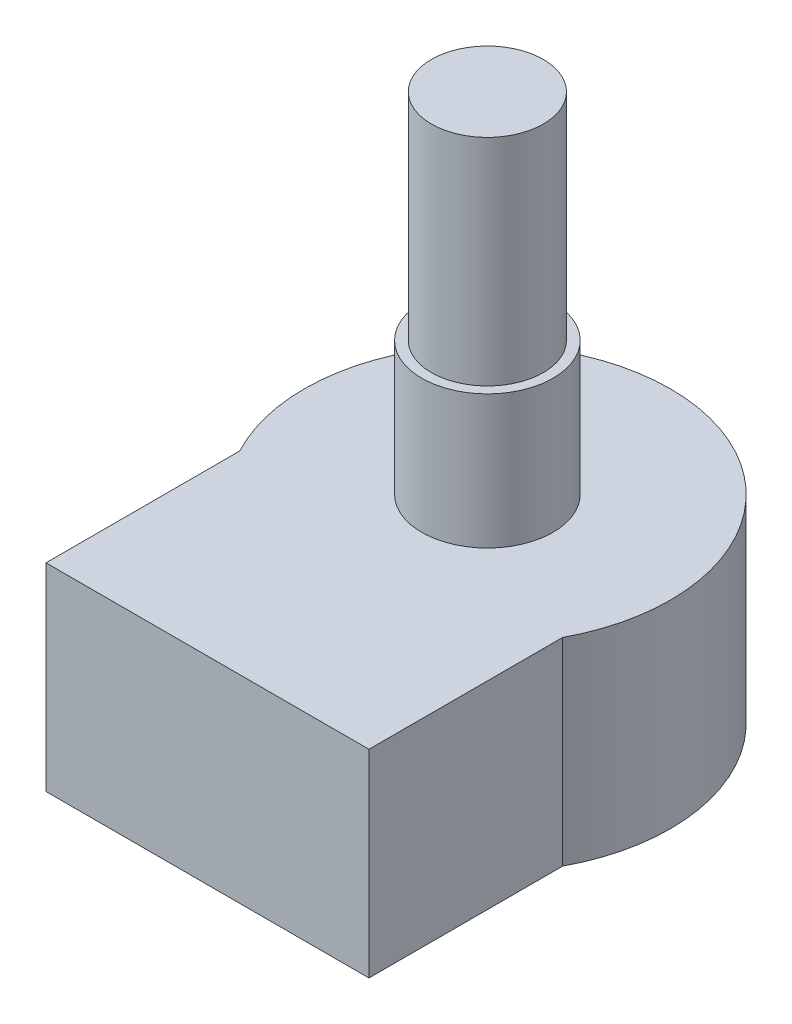
from build123d import *

# Parameters (mm, degrees)
BOSS_EXTRUDE1_DEPTH = 9.2
SKETCH2_R           = 3.05
BOSS_EXTRUDE2_DEPTH = 6.2
SKETCH3_R           = 2.6
BOSS_EXTRUDE3_DEPTH = 10


with BuildPart() as part:
    # Sketch1 → Boss-Extrude1 (new body)
    with BuildSketch(Plane(origin=(0, 0, 0), x_dir=(1, 0, 0), z_dir=(0, 1, 0))):
        with BuildLine():
            ThreePointArc((8.5, 0), (-2.061552813, 8.246211251), (-7.5, -4))
            Line((-7.5, -4), (7.5, -4))
            ThreePointArc((7.5, -4), (8.246211251, -2.061552813), (8.5, 0))
        make_face()
        with BuildLine():
            Line((7.5, -4), (-7.5, -4))
            ThreePointArc((-7.5, -4), (0, -8.5), (7.5, -4))
        make_face()
        with BuildLine():
            ThreePointArc((7.5, -4), (0, -8.5), (-7.5, -4))
            Line((-7.5, -4), (-7.5, -13))
            Line((-7.5, -13), (7.5, -13))
            Line((7.5, -13), (7.5, -4))
        make_face()
    extrude(amount=BOSS_EXTRUDE1_DEPTH)

    # Sketch2 → Boss-Extrude2 (add)
    with BuildSketch(Plane(origin=(0, 9.2, 0), x_dir=(1, 0, 0), z_dir=(0, 1, 0))):
        with Locations(Location((0, 0, 0), (0, 0, 90))):
            Circle(SKETCH2_R)
    extrude(amount=BOSS_EXTRUDE2_DEPTH)

    # Sketch3 → Boss-Extrude3 (add)
    with BuildSketch(Plane(origin=(0, 15.4, 0), x_dir=(1, 0, 0), z_dir=(0, 1, 0))):
        with Locations(Location((0, 0, 0), (0, 0, 270))):
            Circle(SKETCH3_R)
    extrude(amount=BOSS_EXTRUDE3_DEPTH)


solid = part.part
